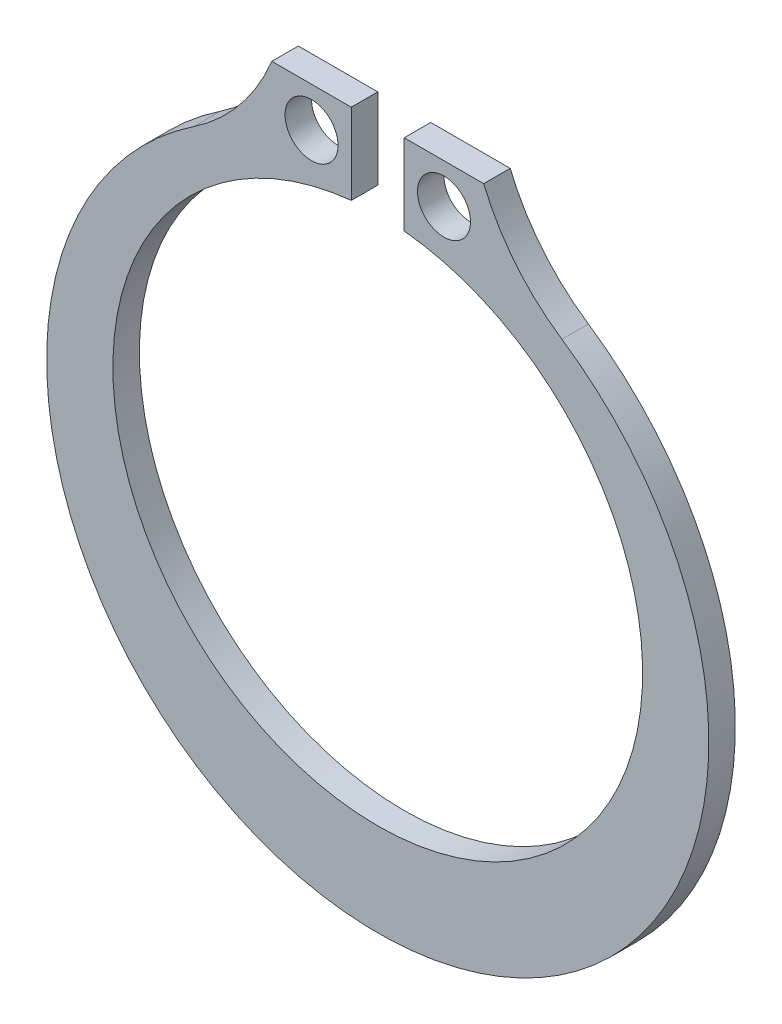
from build123d import *

# Parameters (mm, degrees)
SKETCH1_R           = 1
BOSS_EXTRUDE1_DEPTH = 1


with BuildPart() as part:
    # Sketch1 → Boss-Extrude1 (new body)
    with BuildSketch(Plane.XY):
        with BuildLine():
            Line((-4, 14), (-1, 14))
            Line((-1, 14), (-1, 10.949874371))
            ThreePointArc((-1, 10.949874371), (0, -9), (1, 10.949874371))
            Line((1, 10.949874371), (1, 14))
            Line((1, 14), (4, 14))
            ThreePointArc((4, 14), (5.20687918, 11.974361009), (6.951853926, 10.388538251))
            ThreePointArc((6.951853926, 10.388538251), (0, -12.5), (-6.951853926, 10.388538251))
            ThreePointArc((-6.951853926, 10.388538251), (-5.20687918, 11.974361009), (-4, 14))
        make_face()
        with Locations((-2.5, 12.5)):
            Circle(SKETCH1_R, mode=Mode.SUBTRACT)
        with Locations(Location((2.5, 12.5, 0), (0, 0, 180))):
            Circle(SKETCH1_R, mode=Mode.SUBTRACT)
    extrude(amount=BOSS_EXTRUDE1_DEPTH)


solid = part.part
